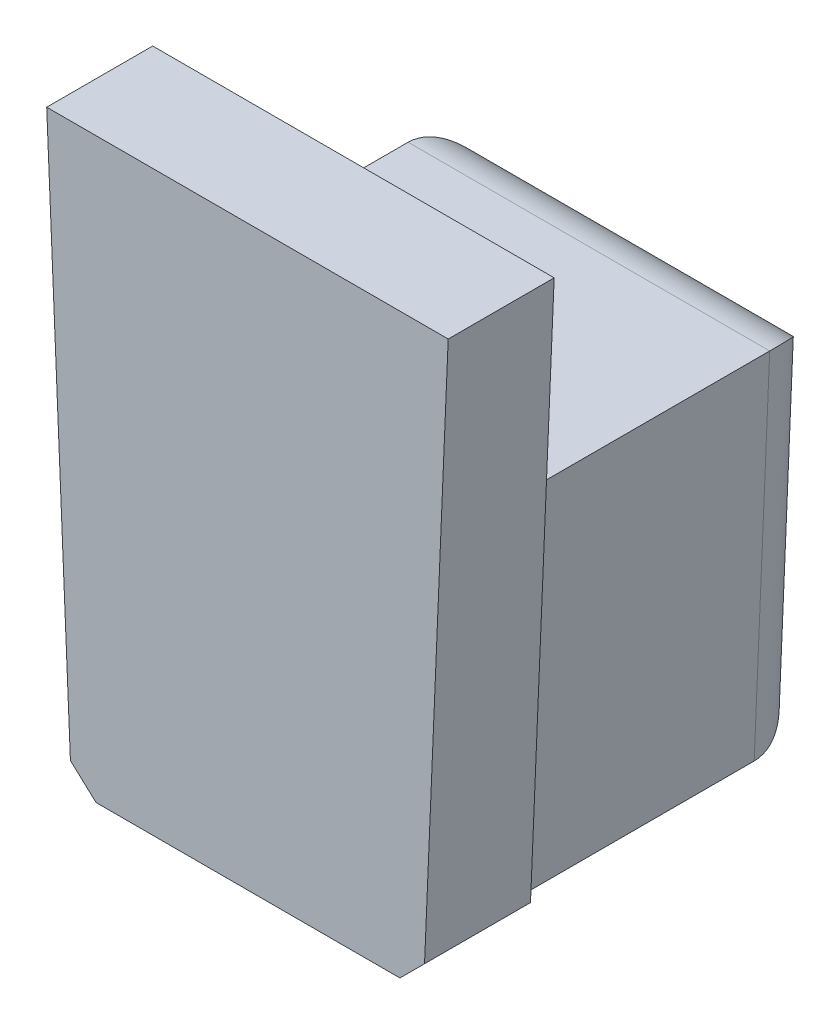
from build123d import *
from OCP.BRepFilletAPI import BRepFilletAPI_MakeChamfer

# Parameters (mm, degrees)
BOSS_EXTRUDE1_DEPTH = 18
BOSS_EXTRUDE2_DEPTH = 50
CHAMFER1_SIZE       = 4
CHAMFER1_SIZE2      = 4.182741942
FILLET1_R           = 10


with BuildPart() as part:
    # Sketch1 → Boss-Extrude1 (new body)
    with BuildSketch(Plane.XY):
        Polygon((0, 0), (68.2, 0), (64, -98.1), (4.2, -98.1), align=None)
    extrude(amount=BOSS_EXTRUDE1_DEPTH)

    # Sketch2 → Boss-Extrude2 (add)
    with BuildSketch(Plane(origin=(0, 0, 0), x_dir=(-1, 0, 0), z_dir=(0, 0, -1))):
        Polygon((-62.16942167, -94.1), (-6.03057833, -94.1), (-3.391390108, -32.456103661), (-64.808609892, -32.456103661), align=None)
    extrude(amount=BOSS_EXTRUDE2_DEPTH)

    # Chamfer1: one chamfer whose edges measure the first distance from different faces: ONE call of the kernel's chamfer builder (chamfer() names one face for all edges)
    chamfer1_edges_1 = [part.edges().sort_by_distance(p)[0] for p in [
        (64, -98.1, 9),
    ]]
    chamfer1_side_1 = [part.faces().sort_by_distance(p)[0] for p in [
        (34.1, -98.1, 9),
    ]]
    chamfer1_edges_2 = [part.edges().sort_by_distance(p)[0] for p in [
        (4.2, -98.1, 9),
    ]]
    chamfer1_side_2 = [part.faces().sort_by_distance(p)[0] for p in [
        (2.1, -49.05, 9),
    ]]
    chamfer1 = BRepFilletAPI_MakeChamfer(part.part.solid().wrapped)
    for e in chamfer1_edges_1:
        chamfer1.Add(CHAMFER1_SIZE, CHAMFER1_SIZE2, e.wrapped, chamfer1_side_1[0].wrapped)  # the first distance lies on this face
    for e in chamfer1_edges_2:
        chamfer1.Add(CHAMFER1_SIZE, CHAMFER1_SIZE2, e.wrapped, chamfer1_side_2[0].wrapped)  # the first distance lies on this face
    add(Compound.cast(chamfer1.Shape()), mode=Mode.REPLACE)

    # Fillet1
    fillet1_edges = [part.edges().sort_by_distance(p)[0] for p in [
        (63.489015781, -63.27805183, -50),
        (34.1, -94.1, -50),
        (4.710984219, -63.27805183, -50),
        (34.1, -32.456103661, -50),
    ]]
    fillet(fillet1_edges, radius=FILLET1_R)


solid = part.part
